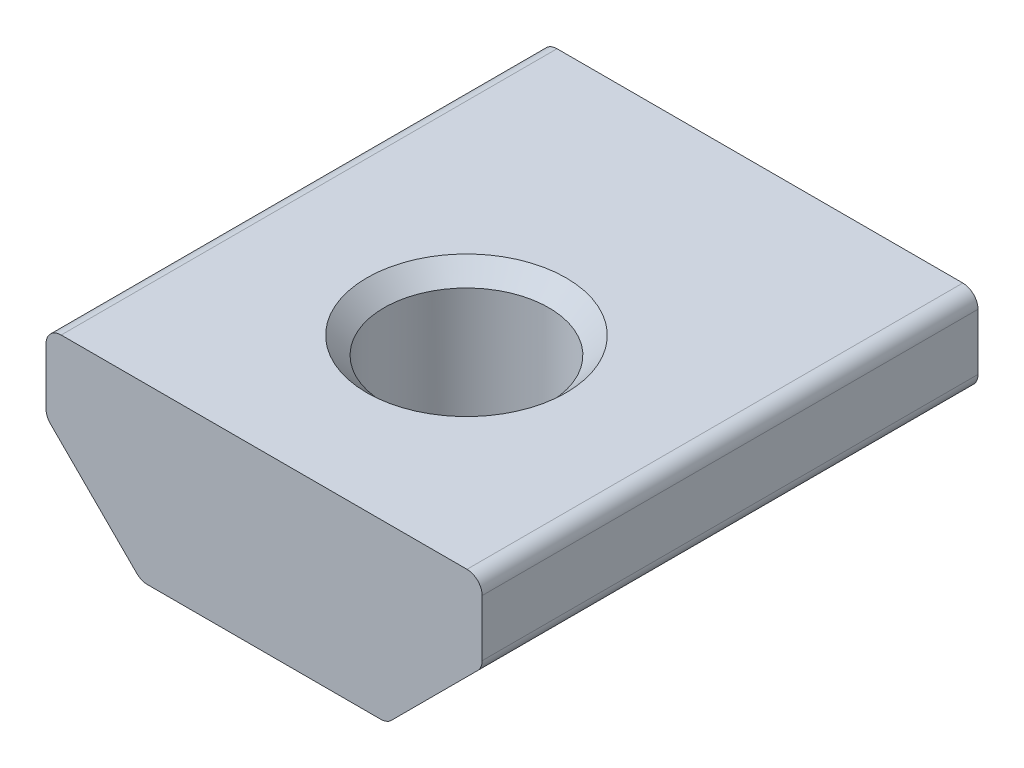
from build123d import *

# Parameters (mm, degrees)
BOSS_EXTRUDE1_DEPTH   = 12.446
F_6_CLEARANCE_HOLE1_D = 4.134
CHAMFER1_SIZE         = 0.433
FILLET1_R             = 0.381


with BuildPart() as part:
    # Sketch1 → Boss-Extrude1 (new body)
    with BuildSketch(Plane.XY.offset(5.08)):
        Polygon((5.4737, 4.3434), (-5.4737, 4.3434), (-5.4737, 2.38887), (-3.08483, 0), (3.08483, 0), (5.4737, 2.38887), align=None)
    extrude(amount=-BOSS_EXTRUDE1_DEPTH)

    # #6 Clearance Hole1 (through all)
    with Locations(Plane(origin=(0, 4.3434, 0), x_dir=(1, 0, 0), z_dir=(0, 1, 0))):
        with Locations((0, 0)):
            Hole(F_6_CLEARANCE_HOLE1_D / 2)

    # Chamfer1
    chamfer1_edges = [part.edges().sort_by_distance(p)[0] for p in [
        (2.067, 4.3434, 0),
        (2.067, 0, 0),
    ]]
    chamfer(chamfer1_edges, length=CHAMFER1_SIZE)

    # Fillet1
    fillet1_edges = [part.edges().sort_by_distance(p)[0] for p in [
        (5.4737, 2.38887, -1.143),
        (3.08483, 0, -1.143),
        (-3.08483, 0, -1.143),
        (-5.4737, 2.38887, -1.143),
        (-5.4737, 4.3434, -1.143),
        (5.4737, 4.3434, -1.143),
    ]]
    fillet(fillet1_edges, radius=FILLET1_R)


solid = part.part
